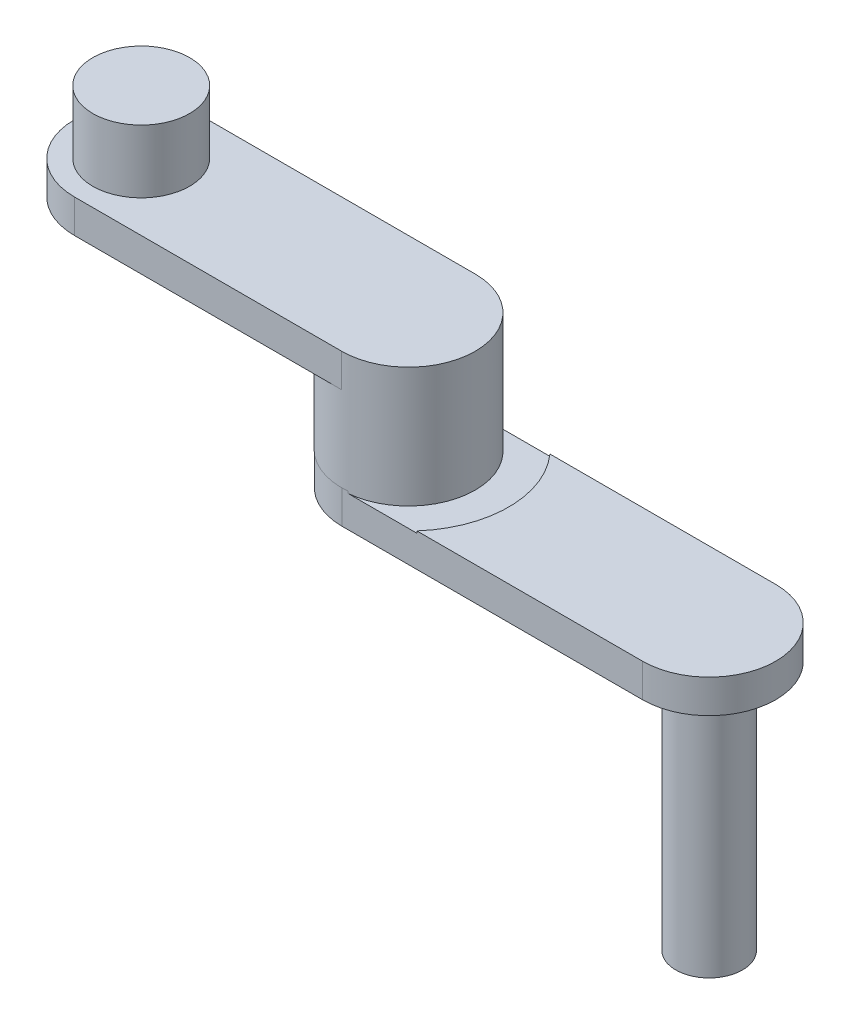
from build123d import *

# Parameters (mm, degrees)
SKETCH1_R           = 30
BOSS_EXTRUDE1_DEPTH = 25.4
BOSS_EXTRUDE2_DEPTH = 10
SKETCH3_R           = 14.5
BOSS_EXTRUDE3_DEPTH = 18.864779219
BOSS_EXTRUDE4_DEPTH = 10
SKETCH5_R           = 10
BOSS_EXTRUDE5_DEPTH = 75
CUT_EXTRUDE1_START  = -26
SKETCH7_R           = 30
SKETCH7_R_2         = 20
CUT_EXTRUDE1_DEPTH  = 26


with BuildPart() as part:
    # Sketch1 → Boss-Extrude1 (new body)
    with BuildSketch(Plane(origin=(0, 0, 0), x_dir=(1, 0, 0), z_dir=(0, 1, 0))):
        with Locations(Location((0, 0, 0), (0, 0, 270))):
            Circle(SKETCH1_R)
    extrude(amount=BOSS_EXTRUDE1_DEPTH)

    # Sketch2 → Boss-Extrude2 (add)
    with BuildSketch(Plane(origin=(0, 25.4, 0), x_dir=(1, 0, 0), z_dir=(0, 1, 0))):
        with BuildLine():
            Line((0, -20), (-80, -20))
            ThreePointArc((-80, -20), (-100, 0), (-80, 20))
            Line((-80, 20), (0, 20))
            ThreePointArc((0, 20), (20, 0), (0, -20))
        make_face()
    extrude(amount=BOSS_EXTRUDE2_DEPTH)

    # Sketch3 → Boss-Extrude3 (add)
    with BuildSketch(Plane(origin=(0, 35.4, 0), x_dir=(1, 0, 0), z_dir=(0, 1, 0))):
        with Locations(Location((-80, 0, 0), (0, 0, 270))):
            Circle(SKETCH3_R)
    extrude(amount=BOSS_EXTRUDE3_DEPTH)

    # Sketch4 → Boss-Extrude4 (add)
    with BuildSketch(Plane.XZ):
        with BuildLine():
            Line((0, 19.919861454), (90, 19.919861454))
            ThreePointArc((90, 19.919861454), (109.919861454, 0), (90, -19.919861454))
            Line((90, -19.919861454), (0, -19.919861454))
            ThreePointArc((0, -19.919861454), (-19.919861454, 0), (0, 19.919861454))
        make_face()
    extrude(amount=BOSS_EXTRUDE4_DEPTH)

    # Sketch5 → Boss-Extrude5 (add)
    with BuildSketch(Plane.XZ.offset(10)):
        with Locations(Location((90, 0, 0), (0, 0, 270))):
            Circle(SKETCH5_R)
    extrude(amount=BOSS_EXTRUDE5_DEPTH)

    # Sketch7 → Cut-Extrude1 (cut)
    with BuildSketch(Plane(origin=(0, 25.4, 0), x_dir=(1, 0, 0), z_dir=(0, 1, 0)).offset(CUT_EXTRUDE1_START)):
        Circle(SKETCH7_R)
        with Locations(Location((0, 0, 0), (0, 0, 90))):
            Circle(SKETCH7_R_2, mode=Mode.SUBTRACT)
    extrude(amount=CUT_EXTRUDE1_DEPTH, mode=Mode.SUBTRACT)


solid = part.part
